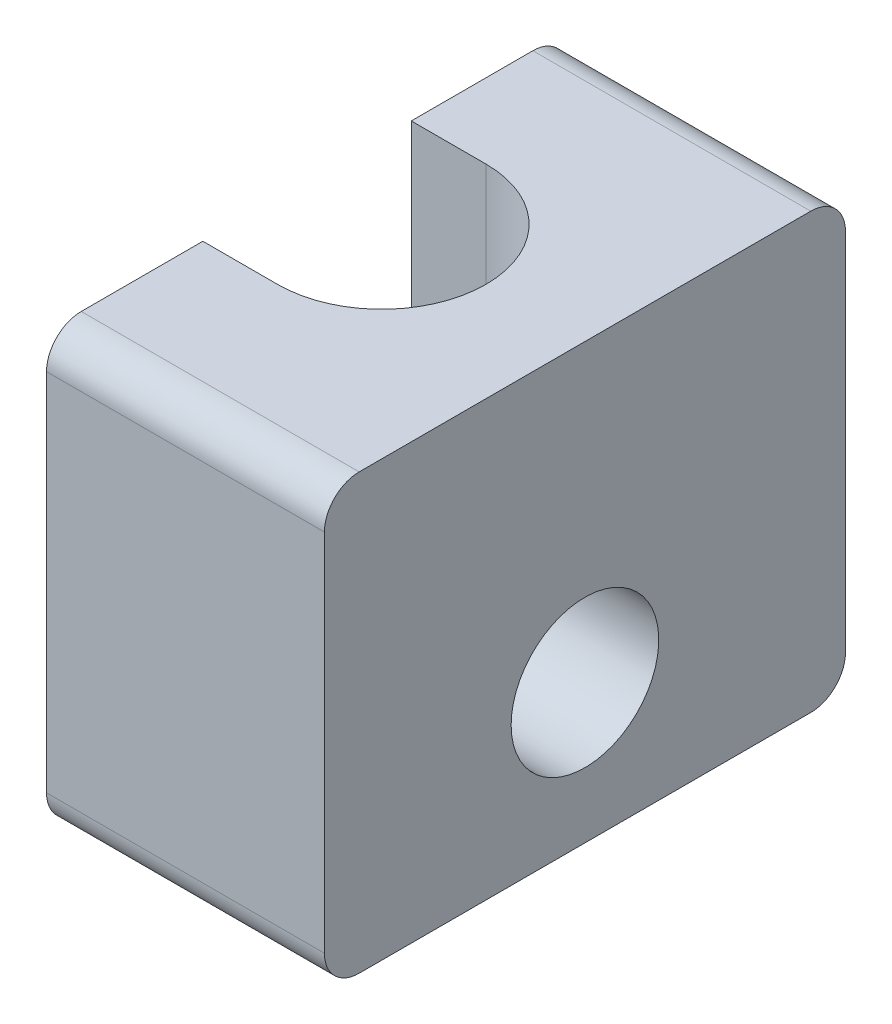
from build123d import *

# Parameters (mm, degrees)
SKETCH1_W           = 16
SKETCH1_H           = 30
BOSS_EXTRUDE1_DEPTH = 25
CUT_EXTRUDE1_DEPTH  = 10
SKETCH3_R           = 4.25
CUT_EXTRUDE2_DEPTH  = 34.256578297
FILLET1_R           = 2


with BuildPart() as part:
    # Sketch1 → Boss-Extrude1 (new body)
    with BuildSketch(Plane(origin=(0, 0, 0), x_dir=(1, 0, 0), z_dir=(0, 1, 0))):
        Rectangle(SKETCH1_W, SKETCH1_H)
    extrude(amount=BOSS_EXTRUDE1_DEPTH)

    # Sketch2 → Cut-Extrude1 (cut)
    with BuildSketch(Plane(origin=(0, 25, 0), x_dir=(1, 0, 0), z_dir=(0, 1, 0))):
        with BuildLine():
            Line((-8, 6), (-3.7, 6))
            ThreePointArc((-3.7, 6), (2.3, 0), (-3.7, -6))
            Line((-3.7, -6), (-8, -6))
            ThreePointArc((-8, -6), (-14, 0), (-8, 6))
        make_face()
    extrude(amount=-CUT_EXTRUDE1_DEPTH, mode=Mode.SUBTRACT)

    # Sketch3 → Cut-Extrude2 (cut, through all)
    with BuildSketch(Plane.ZY.offset(8)):
        with Locations((0, 8)):
            Circle(SKETCH3_R)
    extrude(amount=-CUT_EXTRUDE2_DEPTH, mode=Mode.SUBTRACT)

    # Fillet1
    fillet1_edges = [part.edges().sort_by_distance(p)[0] for p in [
        (0, 25, 15),
        (0, 0, 15),
        (0, 0, -15),
        (0, 25, -15),
    ]]
    fillet(fillet1_edges, radius=FILLET1_R)


solid = part.part
